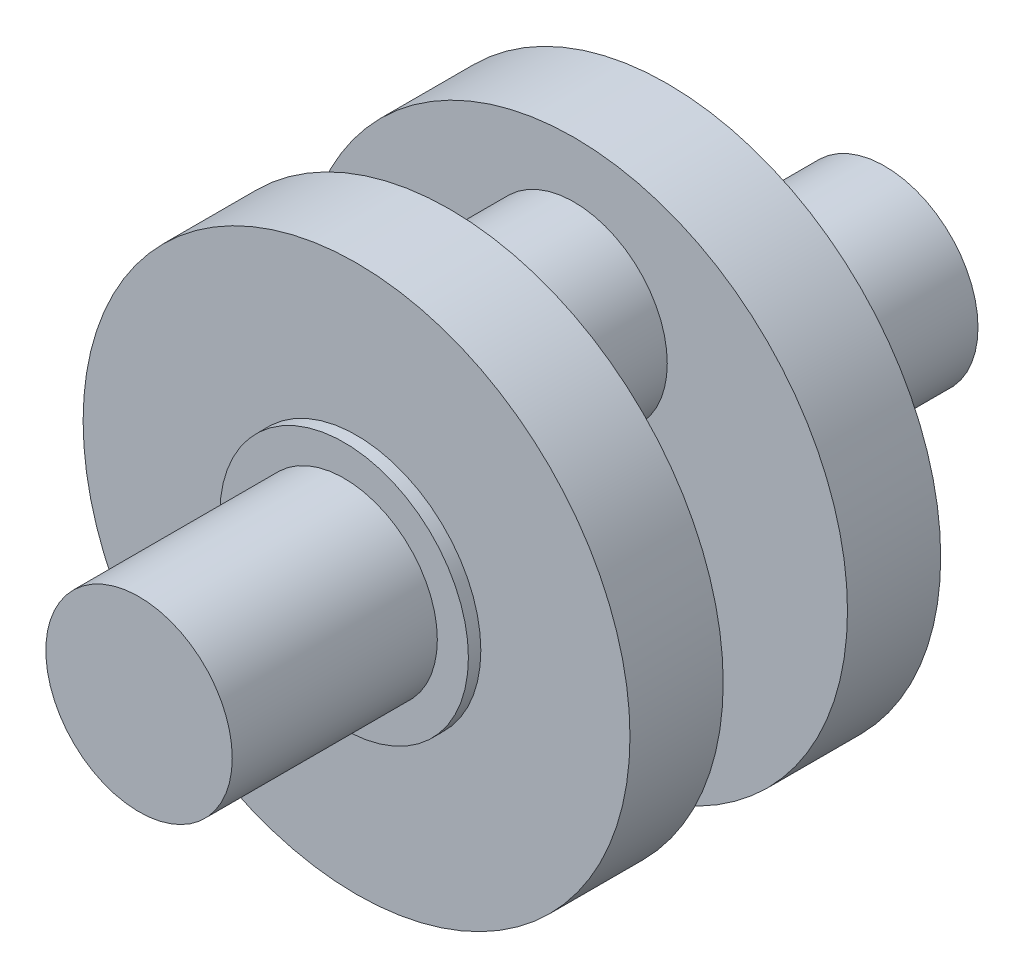
from build123d import *

# Parameters (mm, degrees)
SZKIC3_R                    = 15
DODANIE_WYCI_GNI_CIE2_DEPTH = 33
SZKIC4_R                    = 20
DODANIE_WYCI_GNI_CIE3_DEPTH = 2
DODANIE_WYCI_GNI_CIE4_START = -2
SZKIC5_R                    = 44
DODANIE_WYCI_GNI_CIE4_DEPTH = 15
DODANIE_WYCI_GNI_CIE5_START = -17
SZKIC6_R                    = 15
DODANIE_WYCI_GNI_CIE5_DEPTH = 10


with BuildPart() as part:
    # Szkic3 → Dodanie-wyciągnięcie2 (new body)
    with BuildSketch(Plane.XY):
        Circle(SZKIC3_R)
    extrude(amount=DODANIE_WYCI_GNI_CIE2_DEPTH)

    # Szkic4 → Dodanie-wyciągnięcie3 (add)
    with BuildSketch(Plane.XY):
        Circle(SZKIC4_R)
    extrude(amount=-DODANIE_WYCI_GNI_CIE3_DEPTH)

    # Szkic5 → Dodanie-wyciągnięcie4 (add)
    with BuildSketch(Plane.XY.offset(DODANIE_WYCI_GNI_CIE4_START)):
        Circle(SZKIC5_R)
    extrude(amount=-DODANIE_WYCI_GNI_CIE4_DEPTH)

    # Szkic6 → Dodanie-wyciągnięcie5 (add)
    with BuildSketch(Plane.XY.offset(DODANIE_WYCI_GNI_CIE5_START)):
        with Locations((0, 20)):
            Circle(SZKIC6_R)
    extrude(amount=-DODANIE_WYCI_GNI_CIE5_DEPTH)

    # Lustro1: part across plane


with BuildPart() as part_1:
    add(part.part)
    add(part.part.mirror(Plane(origin=(0, 20, -27), x_dir=(1, 0, 0), z_dir=(0, 0, 1))))


solid = part_1.part
